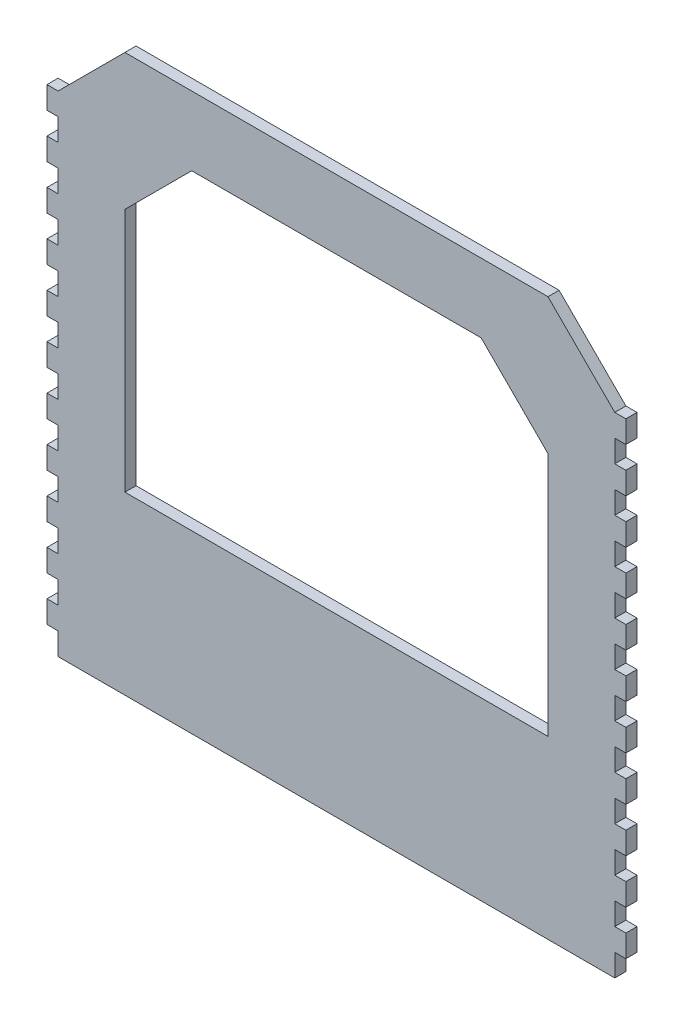
from build123d import *

# Parameters (mm, degrees)
AUFSATZ_LINEAR_AUSTRAGEN2_DEPTH = 5


with BuildPart() as part:
    # Skizze1 → Aufsatz-Linear austragen2 (new body)
    with BuildSketch(Plane.XY):
        Polygon((460.89618142, 291.663856447), (650.89618142, 291.663856447), (680.89618142, 261.663856447), (685.89618142, 261.663856447), (685.89618142, 251.663856447), (680.89618142, 251.663856447), (680.89618142, 241.663856447), (685.89618142, 241.663856447), (685.89618142, 231.663856447), (680.89618142, 231.663856447), (680.89618142, 221.663856447), (685.89618142, 221.663856447), (685.89618142, 211.663856447), (680.89618142, 211.663856447), (680.89618142, 201.663856447), (685.89618142, 201.663856447), (685.89618142, 191.663856447), (680.89618142, 191.663856447), (680.89618142, 181.663856447), (685.89618142, 181.663856447), (685.89618142, 171.663856447), (680.89618142, 171.663856447), (680.89618142, 161.663856447), (685.89618142, 161.663856447), (685.89618142, 151.663856447), (680.89618142, 151.663856447), (680.89618142, 141.663856447), (685.89618142, 141.663856447), (685.89618142, 131.663856447), (680.89618142, 131.663856447), (680.89618142, 121.663856447), (685.89618142, 121.663856447), (685.89618142, 111.663856447), (680.89618142, 111.663856447), (680.89618142, 101.663856447), (685.89618142, 101.663856447), (685.89618142, 91.663856447), (680.89618142, 91.663856447), (680.89618142, 81.663856447), (685.89618142, 81.663856447), (685.89618142, 71.663856447), (680.89618142, 71.663856447), (680.89618142, 61.663856447), (685.89618142, 61.663856447), (685.89618142, 51.663856447), (680.89618142, 51.663856447), (680.89618142, 41.663856447), (430.89618142, 41.663856447), (430.89618142, 51.663856447), (425.89618142, 51.663856447), (425.89618142, 61.663856447), (430.89618142, 61.663856447), (430.89618142, 71.663856447), (425.89618142, 71.663856447), (425.89618142, 81.663856447), (430.89618142, 81.663856447), (430.89618142, 91.663856447), (425.89618142, 91.663856447), (425.89618142, 101.663856447), (430.89618142, 101.663856447), (430.89618142, 111.663856447), (425.89618142, 111.663856447), (425.89618142, 121.663856447), (430.89618142, 121.663856447), (430.89618142, 131.663856447), (425.89618142, 131.663856447), (425.89618142, 141.663856447), (430.89618142, 141.663856447), (430.89618142, 151.663856447), (425.89618142, 151.663856447), (425.89618142, 161.663856447), (430.89618142, 161.663856447), (430.89618142, 171.663856447), (425.89618142, 171.663856447), (425.89618142, 181.663856447), (430.89618142, 181.663856447), (430.89618142, 191.663856447), (425.89618142, 191.663856447), (425.89618142, 201.663856447), (430.89618142, 201.663856447), (430.89618142, 211.663856447), (425.89618142, 211.663856447), (425.89618142, 221.663856447), (430.89618142, 221.663856447), (430.89618142, 231.663856447), (425.89618142, 231.663856447), (425.89618142, 241.663856447), (430.89618142, 241.663856447), (430.89618142, 251.663856447), (425.89618142, 251.663856447), (425.89618142, 261.663856447), (430.89618142, 261.663856447), align=None)
        Polygon((490.89618142, 260.635021844), (620.89618142, 260.635021844), (650.89618142, 230.635021844), (650.89618142, 120.635021844), (460.89618142, 120.635021844), (460.89618142, 230.635021844), align=None, mode=Mode.SUBTRACT)
    extrude(amount=AUFSATZ_LINEAR_AUSTRAGEN2_DEPTH)


solid = part.part
